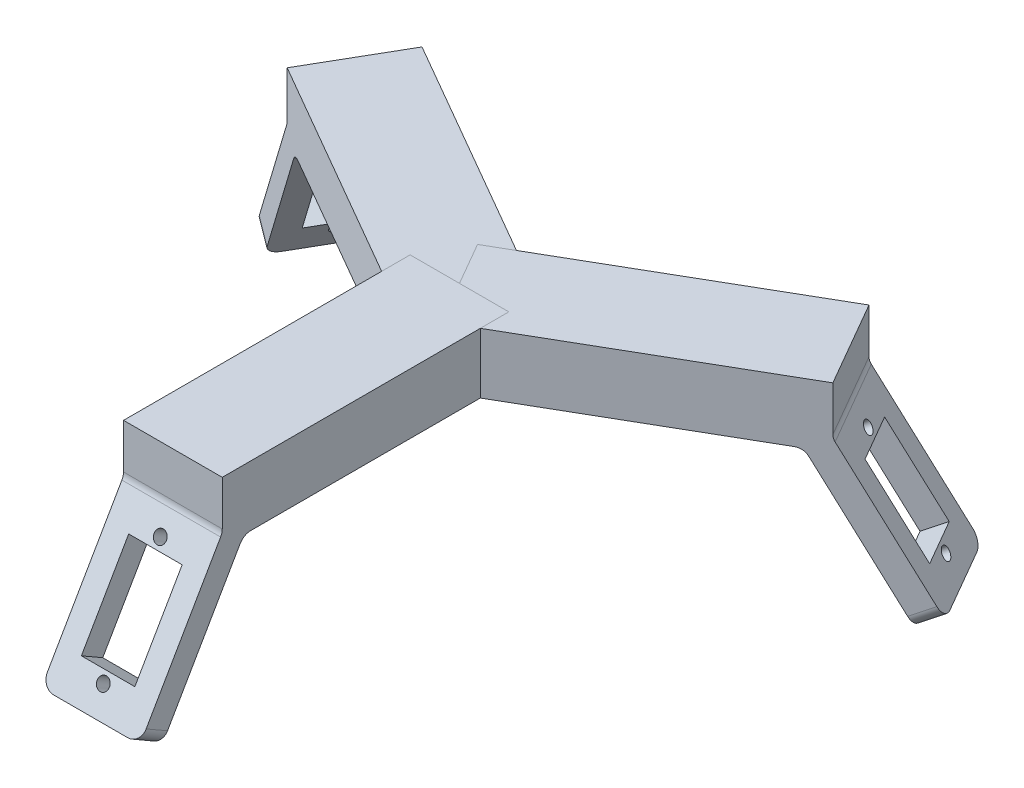
from build123d import *

# Parameters (mm, degrees)
SKETCH_4_W                = 24
SKETCH_4_H                = 40
SKETCH_4_W_2              = 13
SKETCH_4_H_2              = 23
EXTRUDE_1_DEPTH           = 6
EXTRUDE_2_REACH           = 105.044
SKETCH_5_W                = 24
SKETCH_5_H                = 5.196152423
SKETCH_6_W                = 24
SKETCH_6_H                = 14.679491924
EXTRUDE_3_DEPTH           = 64.478184725
PATTERN_CIRCULAR_13_COUNT = 3
SKETCH_7_R                = 1.5
CUT_EXTRUDE_1_DEPTH       = 10
SKETCH_8_R                = 1.5
CUT_EXTRUDE_2_DEPTH       = 10
SKETCH_9_R                = 1.5
CUT_EXTRUDE_3_DEPTH       = 10
FILLET_1_R                = 3
FILLET_2_R                = 3
FILLET_3_R                = 3
FILLET_4_R                = 3
FILLET_5_R                = 3
FILLET_6_R                = 3


with BuildPart() as part:
    # 草图4 → 凸台-拉伸1 (new body)
    with BuildSketch(Plane(origin=(0, 43, 74.478184725), x_dir=(-1, 0, 0), z_dir=(0, 0.500000000000001, 0.866025403784438))):
        Rectangle(SKETCH_4_W, SKETCH_4_H)
        Rectangle(SKETCH_4_W_2, SKETCH_4_H_2, mode=Mode.SUBTRACT)
    extrude(amount=EXTRUDE_1_DEPTH)

    # 草图5 → 凸台-拉伸2 (add, up to next)
    with BuildSketch(Plane(origin=(0, 75, 0), x_dir=(1, 0, 0), z_dir=(0, 1, 0)), mode=Mode.PRIVATE) as extrude_2_sk1:
        with Locations((0, -67.076260937)):
            Rectangle(SKETCH_5_W, SKETCH_5_H)
    extrude_2_tool1 = extrude(extrude_2_sk1.sketch, amount=-EXTRUDE_2_REACH, mode=Mode.PRIVATE) - part.part
    add(extrude_2_tool1.solids().sort_by_distance((0, 75, 67.076261))[0])

    # 草图6 → 凸台-拉伸3 (add)
    with BuildSketch(Plane(origin=(0, 0, 64.478184725), x_dir=(-1, 0, 0), z_dir=(0, 0, -1))):
        with Locations((0, 67.660254038)):
            Rectangle(SKETCH_6_W, SKETCH_6_H)
    extrude(amount=EXTRUDE_3_DEPTH)


with BuildPart() as pattern_circular_13_1:
    # 阵列(圆周)13: pattern copy
    add(part.part.rotate(Axis((0, 0, 0), (0, 1, 0)), 1 * 360 / PATTERN_CIRCULAR_13_COUNT))

    # 草图9 → 切除-拉伸3 (cut)
    with BuildSketch(Plane(origin=(64.5, 43, -37.239092363), x_dir=(0.36028834606144033, 0.2401922307076262, 0.9013878188660008), z_dir=(-0.7500000000000038, -0.5000000000000009, 0.4330127018922121))):
        with Locations(Location((3.841298859, 13.306649581, 0), (0, 0, 270))):
            Circle(SKETCH_9_R)
        with Locations(Location((-3.841298859, -13.306649581, 0), (0, 0, 270))):
            Circle(SKETCH_9_R)
    extrude(amount=-CUT_EXTRUDE_3_DEPTH, mode=Mode.SUBTRACT)

    # 圆角1
    fillet_1_edges = [pattern_circular_13_1.edges().sort_by_distance(p)[0] for p in [
        (60.339745962, 63.320508076, -34.837168574),
        (55.839745962, 60.320508076, -32.239092363),
    ]]
    fillet(fillet_1_edges, radius=FILLET_1_R)

    # 圆角4
    fillet_4_edges = [pattern_circular_13_1.edges().sort_by_distance(p)[0] for p in [
        (69.410254038, 27.179491924, -53.930435314),
        (81.410254038, 27.179491924, -33.145825623),
    ]]
    fillet(fillet_4_edges, radius=FILLET_4_R)


with BuildPart() as pattern_circular_13_2:
    # 阵列(圆周)13: pattern copy
    add(part.part.rotate(Axis((0, 0, 0), (0, 1, 0)), 2 * 360 / PATTERN_CIRCULAR_13_COUNT))

    # 草图8 → 切除-拉伸2 (cut)
    with BuildSketch(Plane(origin=(-64.5, 43, -37.239092363), x_dir=(0.3602883460614483, -0.24019223070763335, -0.9013878188659957), z_dir=(0.7499999999999976, -0.500000000000001, 0.4330127018922227))):
        with Locations(Location((-3.841298859, 13.306649581, 0), (0, 0, 90))):
            Circle(SKETCH_8_R)
        with Locations(Location((3.841298859, -13.306649581, 0), (0, 0, 90))):
            Circle(SKETCH_8_R)
    extrude(amount=-CUT_EXTRUDE_2_DEPTH, mode=Mode.SUBTRACT)

    # 圆角3
    fillet_3_edges = [pattern_circular_13_2.edges().sort_by_distance(p)[0] for p in [
        (-60.339745962, 63.320508076, -34.837168574),
        (-55.839745962, 60.320508076, -32.239092363),
    ]]
    fillet(fillet_3_edges, radius=FILLET_3_R)

    # 圆角5
    fillet_5_edges = [pattern_circular_13_2.edges().sort_by_distance(p)[0] for p in [
        (-81.410254038, 27.179491924, -33.145825623),
        (-69.410254038, 27.179491924, -53.930435314),
    ]]
    fillet(fillet_5_edges, radius=FILLET_5_R)


with BuildPart() as part_1:
    add(part.part)

    # 草图7 → 切除-拉伸1 (cut)
    with BuildSketch(Plane(origin=(0, 43, 74.478184725), x_dir=(-1, 0, 0), z_dir=(0, 0.500000000000001, 0.866025403784438))):
        with Locations(Location((0, 13.85, 0), (0, 0, 270))):
            Circle(SKETCH_7_R)
        with Locations(Location((0, -13.85, 0), (0, 0, 270))):
            Circle(SKETCH_7_R)
    extrude(amount=CUT_EXTRUDE_1_DEPTH, mode=Mode.SUBTRACT)

    # 圆角2
    fillet_2_edges = [part_1.edges().sort_by_distance(p)[0] for p in [
        (0, 63.320508076, 69.674337148),
        (0, 60.320508076, 64.478184725),
    ]]
    fillet(fillet_2_edges, radius=FILLET_2_R)

    # 圆角6
    fillet_6_edges = [part_1.edges().sort_by_distance(p)[0] for p in [
        (12, 27.179491924, 87.076260937),
        (-12, 27.179491924, 87.076260937),
    ]]
    fillet(fillet_6_edges, radius=FILLET_6_R)


solid = Compound([pattern_circular_13_1.part, pattern_circular_13_2.part, part_1.part])
